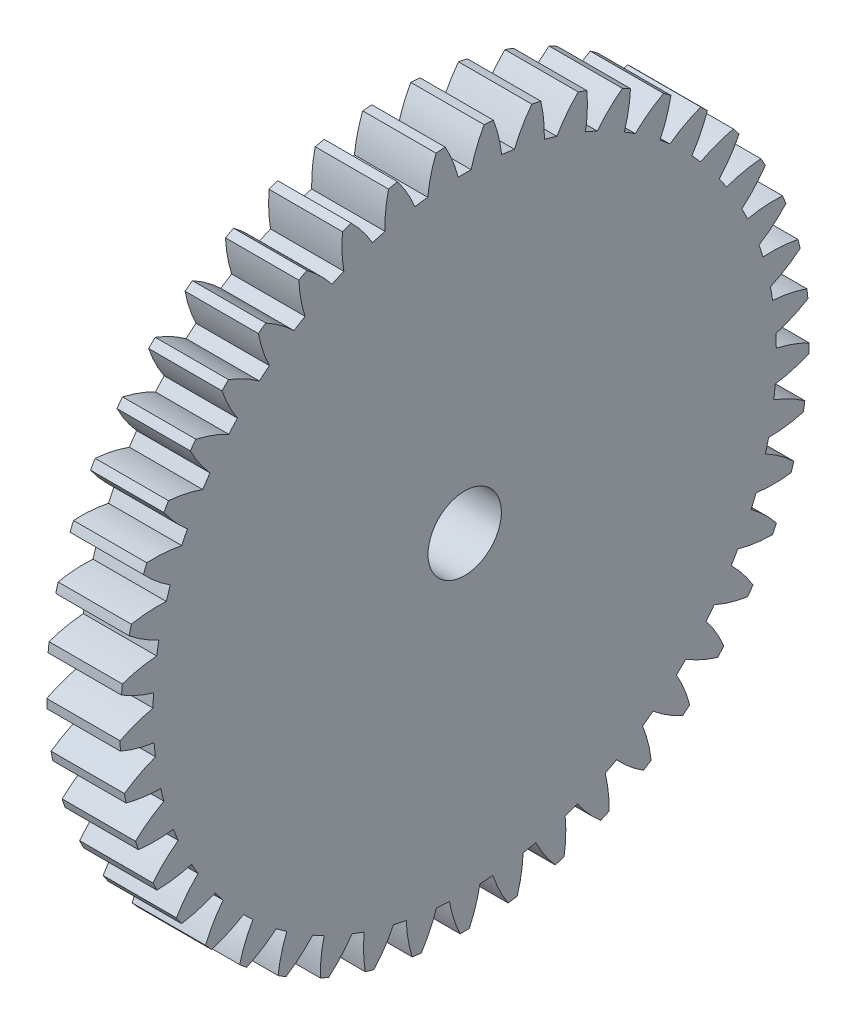
from build123d import *

# Parameters (mm, degrees)
BASPROSKE_W     = 5
BASPROSKE_H     = 23.5
TOOTHCUT_DEPTH  = 34.608034754
TEETHCUTS_COUNT = 45
TEETHCUTS_ANGLE = 352
BORSKE_R        = 2.5
BORE_DEPTH      = 50.0000508


with BuildPart() as part:
    # BasProSke → Base-Revolve (revolve)
    with BuildSketch(Plane(origin=(0, 0, 0), x_dir=(1, 0, 0), z_dir=(0, 1, 0)), mode=Mode.PRIVATE) as base_revolve_sk:
        with Locations((2.5, 11.75)):
            Rectangle(BASPROSKE_W, BASPROSKE_H)
    revolve(base_revolve_sk.sketch.rotate(Axis((-10, 0, 0), (1, 0, 0)), 180), axis=Axis((-10, 0, 0), (1, 0, 0)))

    # TooCutSke → ToothCut (cut, through all)
    with BuildSketch(Plane(origin=(0, 0, 0), x_dir=(0, 0, -1), z_dir=(1, 0, 0))):
        with BuildLine():
            ThreePointArc((0.442593582, 21.244390128), (0, 21.249), (-0.442593582, 21.244390128))
            ThreePointArc((-0.442593582, 21.244390128), (-0.816027501, 22.396050003), (-1.340654493, 23.487168639))
            ThreePointArc((-1.340654493, 23.487168639), (0, 23.5254), (1.340654493, 23.487168639))
            ThreePointArc((1.340654493, 23.487168639), (0.816027501, 22.396050003), (0.442593582, 21.244390128))
        make_face()
    toothcut = extrude(amount=TOOTHCUT_DEPTH, mode=Mode.SUBTRACT)

    # TeethCuts: ToothCut ×45 about axis
    teethcuts_axis = Axis((-10, 0, 0), (1, 0, 0))
    for i in range(1, TEETHCUTS_COUNT):
        add(toothcut.rotate(teethcuts_axis, i * TEETHCUTS_ANGLE / (TEETHCUTS_COUNT - 1)), mode=Mode.SUBTRACT)

    # BorSke → Bore (cut, symmetric)
    with BuildSketch(Plane(origin=(0, 0, 0), x_dir=(0, 0, -1), z_dir=(1, 0, 0))):
        with Locations(Location((0, 0, 0), (0, 0, 180))):
            Circle(BORSKE_R)
    extrude(amount=BORE_DEPTH, both=True, mode=Mode.SUBTRACT)


solid = part.part
